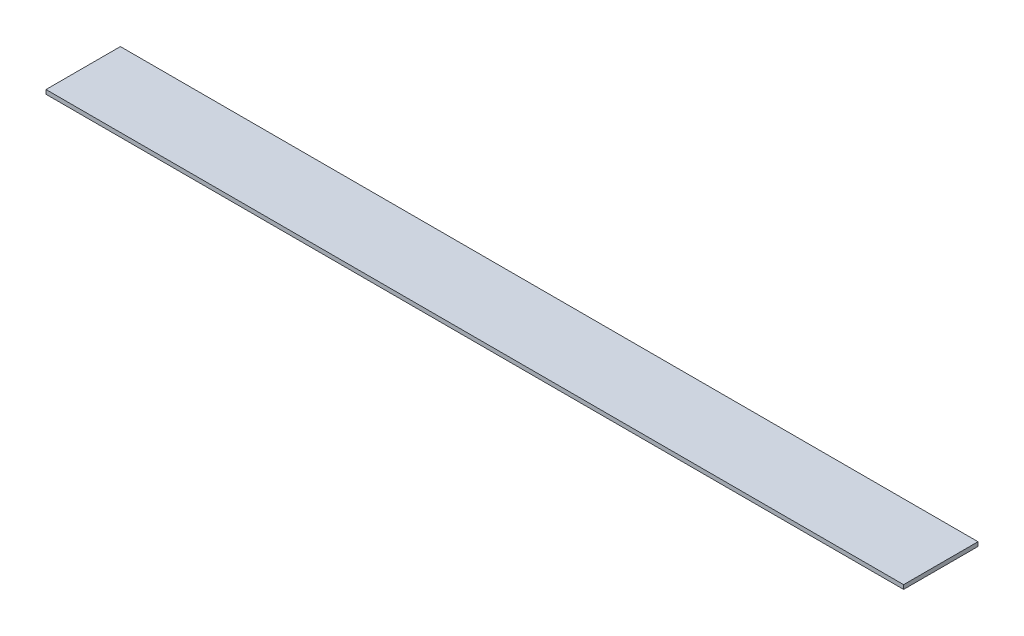
from build123d import *

# Parameters (mm, degrees)
SKETCH1_W           = 392
SKETCH1_H           = 34
BOSS_EXTRUDE1_DEPTH = 1.9


with BuildPart() as part:
    # Sketch1 → Boss-Extrude1 (new body)
    with BuildSketch(Plane(origin=(0, 0, 0), x_dir=(1, 0, 0), z_dir=(0, 1, 0))):
        with Locations((196, 17)):
            Rectangle(SKETCH1_W, SKETCH1_H)
    extrude(amount=BOSS_EXTRUDE1_DEPTH)


solid = part.part
